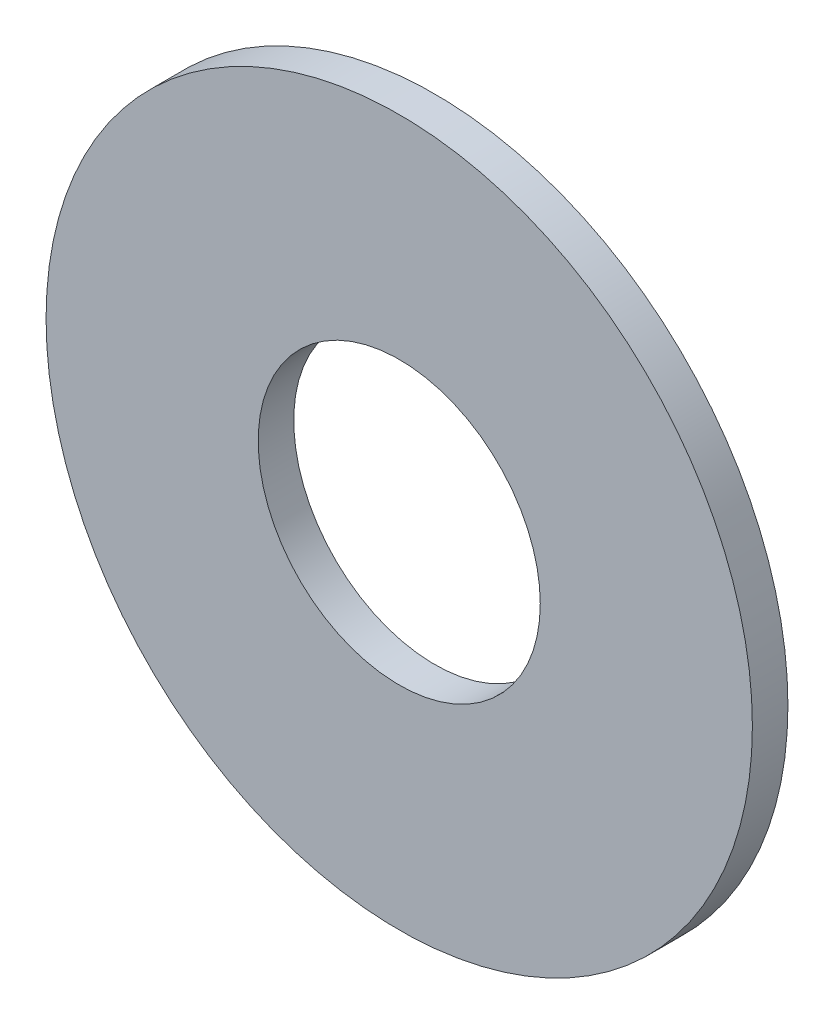
from build123d import *

# Parameters (mm, degrees)
SKETCH1_R      = 3.975
SKETCH1_R_2    = 1.5875
EXTRUDE1_DEPTH = 0.4


with BuildPart() as part:
    # Sketch1 → Extrude1 (new body)
    with BuildSketch(Plane.XY):
        Circle(SKETCH1_R)
        Circle(SKETCH1_R_2, mode=Mode.SUBTRACT)
    extrude(amount=-EXTRUDE1_DEPTH)


solid = part.part
